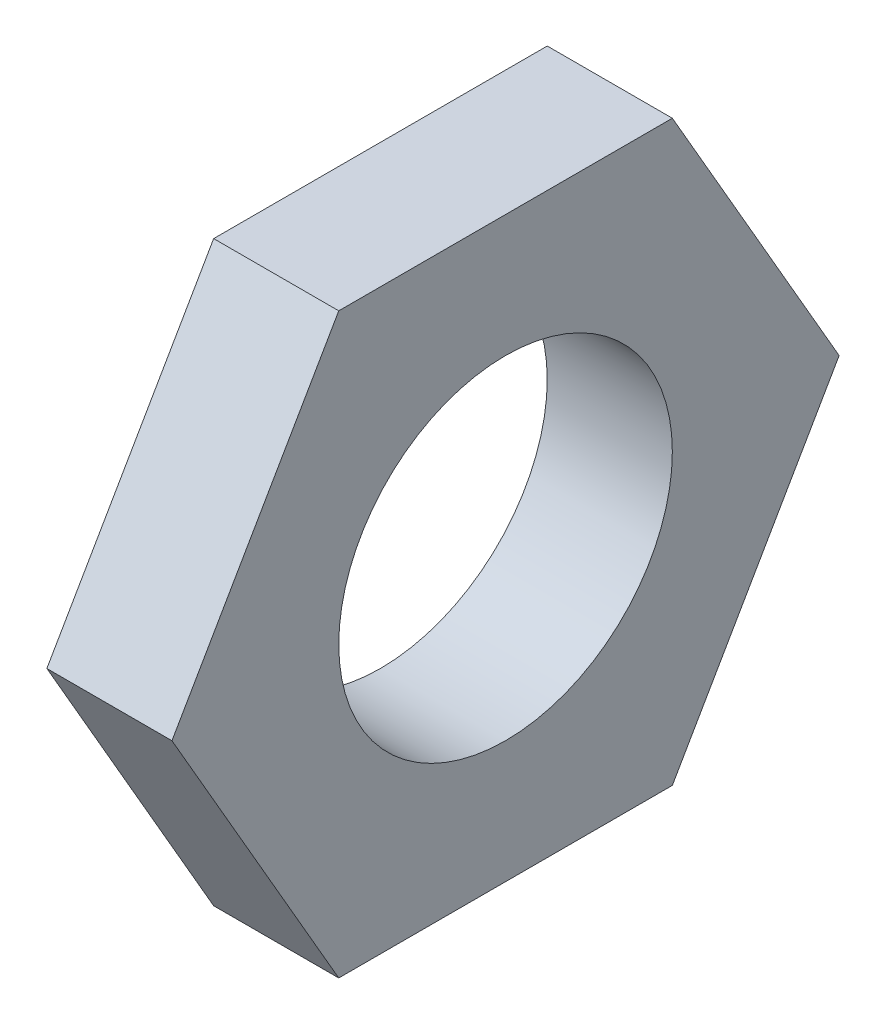
from build123d import *

# Parameters (mm, degrees)
CROQUIS1_R              = 4
SALIENTE_EXTRUIR1_DEPTH = 3


with BuildPart() as part:
    # Croquis1 → Saliente-Extruir1 (new body)
    with BuildSketch(Plane(origin=(0, 0, 0), x_dir=(0, 0, -1), z_dir=(1, 0, 0))):
        Polygon((8, 0), (4, 6.92820323), (-4, 6.92820323), (-8, 0), (-4, -6.92820323), (4, -6.92820323), align=None)
        Circle(CROQUIS1_R, mode=Mode.SUBTRACT)
    extrude(amount=SALIENTE_EXTRUIR1_DEPTH)


solid = part.part
